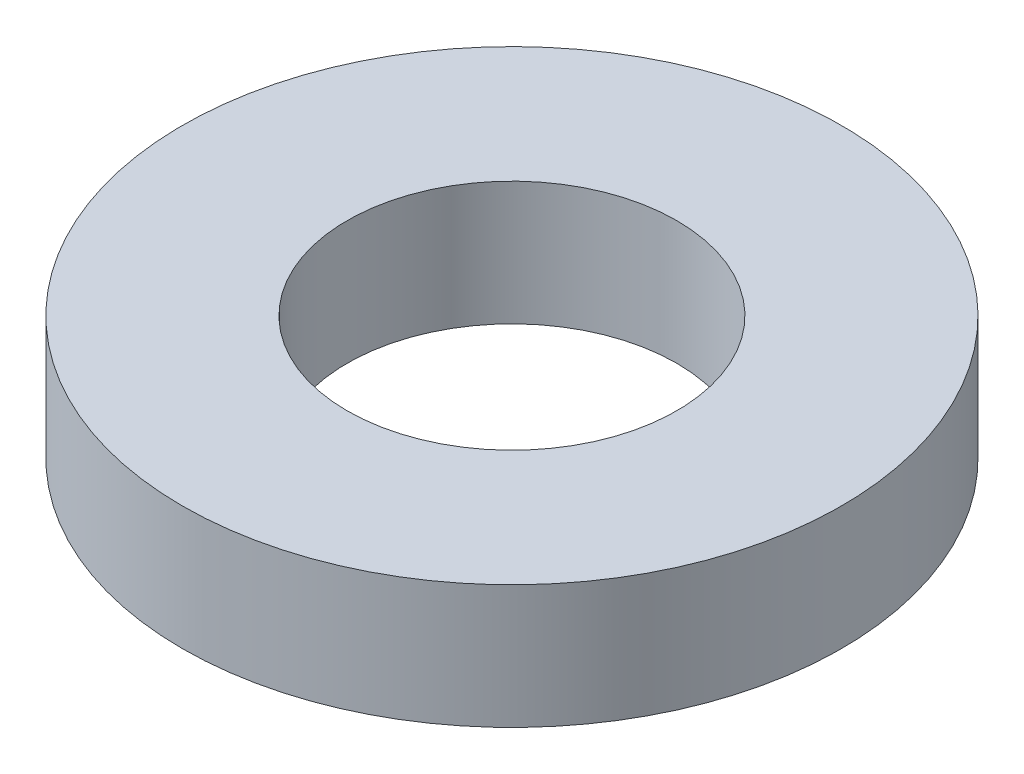
from build123d import *

# Parameters (mm, degrees)
SKETCH1_R           = 2
SKETCH1_R_2         = 1
BOSS_EXTRUDE1_DEPTH = 0.75


with BuildPart() as part:
    # Sketch1 → Boss-Extrude1 (new body)
    with BuildSketch(Plane(origin=(0, 0, 0), x_dir=(1, 0, 0), z_dir=(0, 1, 0))):
        with Locations(Location((0, 0, 0), (0, 0, 270))):
            Circle(SKETCH1_R)
        with Locations(Location((0, 0, 0), (0, 0, 270))):
            Circle(SKETCH1_R_2, mode=Mode.SUBTRACT)
    extrude(amount=BOSS_EXTRUDE1_DEPTH)


solid = part.part
